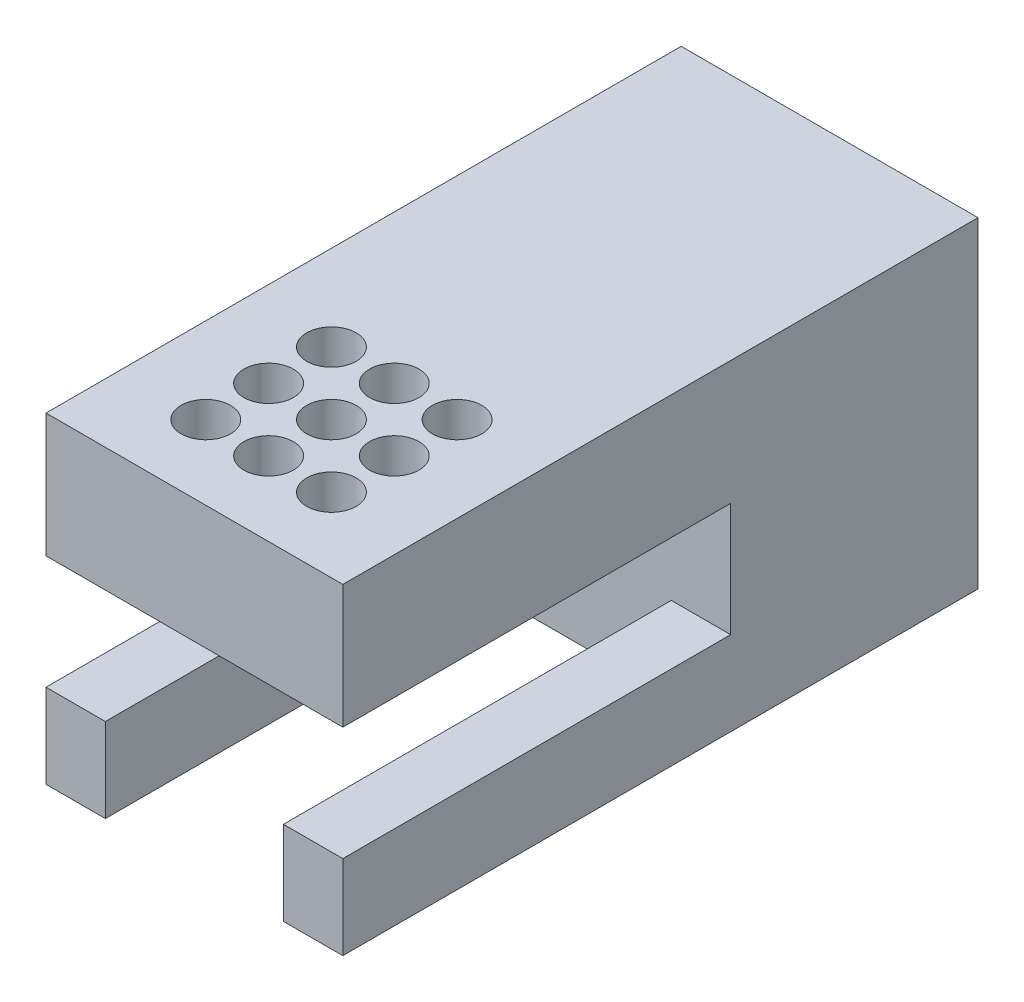
from build123d import *

# Parameters (mm, degrees)
SKETCH1_W           = 12
SKETCH1_H           = 10
SKETCH1_H_2         = 15.68
SKETCH1_R           = 1
BOSS_EXTRUDE1_DEPTH = 5
SKETCH1_3_W         = 12
SKETCH1_3_H         = 10
BOSS_EXTRUDE2_DEPTH = 8
SKETCH2_W           = 2.4
SKETCH2_H           = 3.4
BOSS_EXTRUDE3_DEPTH = 15.68


with BuildPart() as part:
    # Sketch1 → Boss-Extrude1 (new body)
    # profile 1 of 2: a face of its own
    with BuildSketch(Plane(origin=(0, 0, 0), x_dir=(1, 0, 0), z_dir=(0, 1, 0))):
        with Locations((0, 15.14)):
            Rectangle(SKETCH1_W, SKETCH1_H)
    # profile 2 of 2: a face of its own
    with BuildSketch(Plane(origin=(0, 0, 0), x_dir=(1, 0, 0), z_dir=(0, 1, 0))):
        with Locations((0, 2.3)):
            Rectangle(SKETCH1_W, SKETCH1_H_2)
        with Locations(Location((-2.54, -2.54, 0), (0, 0, 270))):
            Circle(SKETCH1_R, mode=Mode.SUBTRACT)
        with Locations(Location((-2.54, 0, 0), (0, 0, 270))):
            Circle(SKETCH1_R, mode=Mode.SUBTRACT)
        with Locations(Location((0, 0, 0), (0, 0, 270))):
            Circle(SKETCH1_R, mode=Mode.SUBTRACT)
        with Locations(Location((-2.54, 2.54, 0), (0, 0, 270))):
            Circle(SKETCH1_R, mode=Mode.SUBTRACT)
        with Locations(Location((0, 2.54, 0), (0, 0, 270))):
            Circle(SKETCH1_R, mode=Mode.SUBTRACT)
        with Locations(Location((0, -2.54, 0), (0, 0, 270))):
            Circle(SKETCH1_R, mode=Mode.SUBTRACT)
        with Locations(Location((2.54, -2.54, 0), (0, 0, 270))):
            Circle(SKETCH1_R, mode=Mode.SUBTRACT)
        with Locations(Location((2.54, 0, 0), (0, 0, 270))):
            Circle(SKETCH1_R, mode=Mode.SUBTRACT)
        with Locations(Location((2.54, 2.54, 0), (0, 0, 270))):
            Circle(SKETCH1_R, mode=Mode.SUBTRACT)
    extrude(amount=BOSS_EXTRUDE1_DEPTH)

    # Sketch1<3> → Boss-Extrude2 (add)
    with BuildSketch(Plane(origin=(0, 0, 0), x_dir=(1, 0, 0), z_dir=(0, 1, 0))):
        with Locations((0, 15.14)):
            Rectangle(SKETCH1_3_W, SKETCH1_3_H)
    extrude(amount=-BOSS_EXTRUDE2_DEPTH)

    # Sketch2 → Boss-Extrude3 (add)
    with BuildSketch(Plane.XY.offset(-10.14)):
        with Locations((-4.8, -6.3)):
            Rectangle(SKETCH2_W, SKETCH2_H)
        with Locations((4.8, -6.3)):
            Rectangle(SKETCH2_W, SKETCH2_H)
    extrude(amount=BOSS_EXTRUDE3_DEPTH)


solid = part.part
